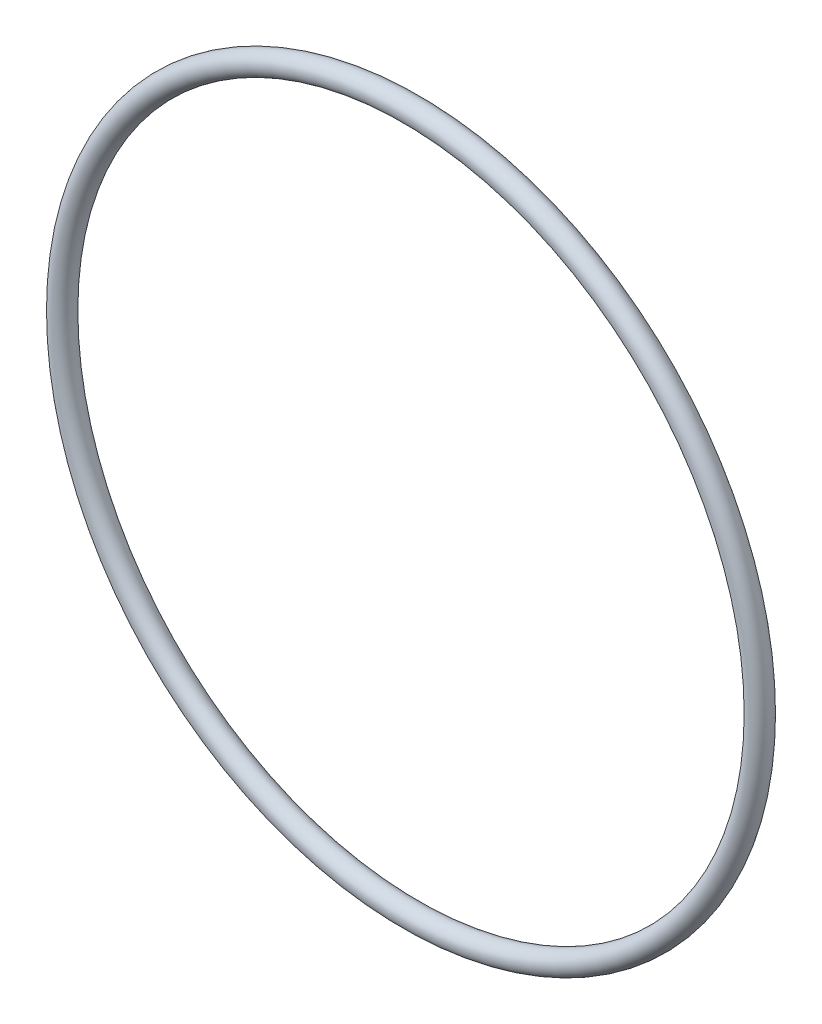
from build123d import *

# Parameters (mm, degrees)
SKETCH1_R = 1.7653


with BuildPart() as part:
    # Sketch1 → Revolve1 (revolve)
    with BuildSketch(Plane(origin=(0, 0, 0), x_dir=(0, -1, 0), z_dir=(1, 0, 0))):
        with Locations((55.5371, 0)):
            Circle(SKETCH1_R)
    revolve(axis=Axis((0, 0, 1.7653), (0, 0, -1)))


solid = part.part
